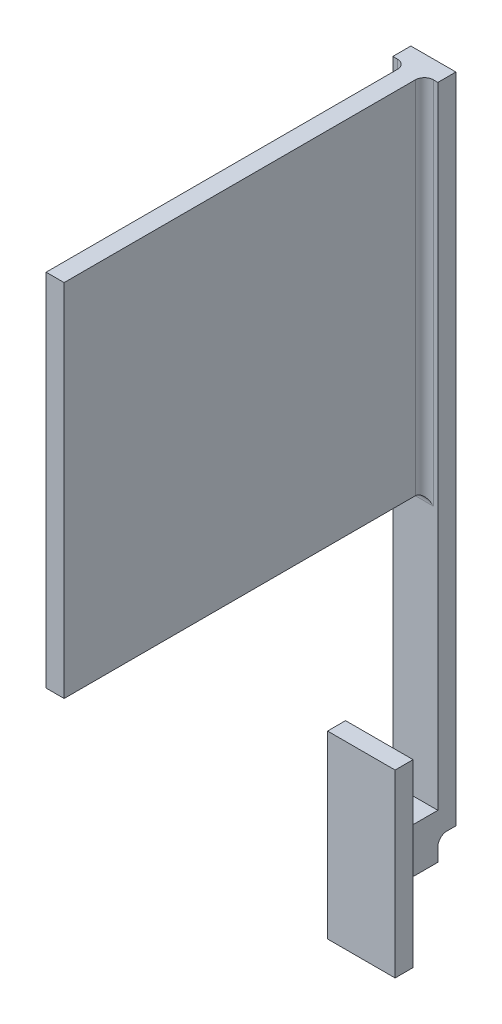
from build123d import *

# Parameters (mm, degrees)
SKETCH1_W           = 7.5
SKETCH1_H           = 20
BOSS_EXTRUDE1_DEPTH = 2
SKETCH2_W           = 5
SKETCH2_H           = 5
BOSS_EXTRUDE2_DEPTH = 4
SKETCH3_W           = 5
SKETCH3_H           = 72.5
BOSS_EXTRUDE3_DEPTH = 2
SKETCH4_W           = 2
SKETCH4_H           = 40
BOSS_EXTRUDE4_DEPTH = 40
FILLET1_R           = 1
FILLET2_R           = 1


with BuildPart() as part:
    # Sketch1 → Boss-Extrude1 (new body)
    with BuildSketch(Plane.XY):
        Rectangle(SKETCH1_W, SKETCH1_H)
    extrude(amount=BOSS_EXTRUDE1_DEPTH)

    # Sketch2 → Boss-Extrude2 (add)
    with BuildSketch(Plane(origin=(0, 0, 0), x_dir=(-1, 0, 0), z_dir=(0, 0, -1))):
        Rectangle(SKETCH2_W, SKETCH2_H)
    extrude(amount=BOSS_EXTRUDE2_DEPTH)

    # Sketch3 → Boss-Extrude3 (add)
    with BuildSketch(Plane(origin=(0, 0, -4), x_dir=(-1, 0, 0), z_dir=(0, 0, -1))):
        with Locations((0, 36.25)):
            Rectangle(SKETCH3_W, SKETCH3_H)
    extrude(amount=BOSS_EXTRUDE3_DEPTH)

    # Sketch4 → Boss-Extrude4 (add)
    with BuildSketch(Plane.XY.offset(-4)):
        with Locations((0, 52.5)):
            Rectangle(SKETCH4_W, SKETCH4_H)
    extrude(amount=BOSS_EXTRUDE4_DEPTH)

    # Fillet1
    fillet1_edges = [part.edges().sort_by_distance(p)[0] for p in [
        (0, 0, -4),
    ]]
    fillet(fillet1_edges, radius=FILLET1_R)

    # Fillet2
    fillet2_edges = [part.edges().sort_by_distance(p)[0] for p in [
        (-1, 52.5, -4),
        (0, 32.5, -4),
        (1, 52.5, -4),
    ]]
    fillet(fillet2_edges, radius=FILLET2_R)


solid = part.part
